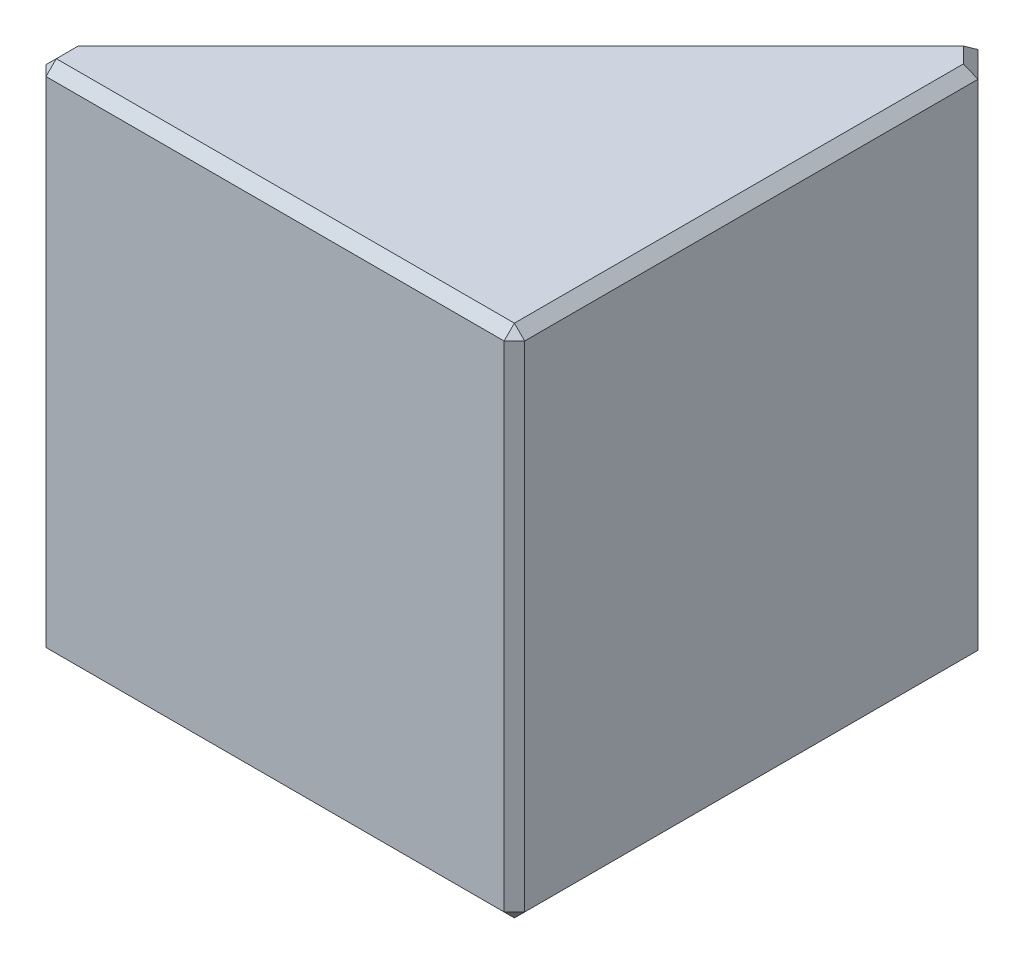
from build123d import *
from OCP.BRepFilletAPI import BRepFilletAPI_MakeChamfer

# Parameters (mm, degrees)
EXTRUDE_1_DEPTH = 50
CHAMFER_1_SIZE  = 5
CHAMFER_1_SIZE2 = 3.535533906
CHAMFER_2_SIZE  = 1


with BuildPart() as part:
    # 草图1 → 凸台-拉伸1 (new body)
    with BuildSketch(Plane(origin=(0, 0, 0), x_dir=(1, 0, 0), z_dir=(0, 1, 0))):
        Polygon((0, 0), (50, 50), (50, 0), align=None)
    extrude(amount=EXTRUDE_1_DEPTH)

    # 倒角1: one chamfer whose edges measure the first distance from different faces: ONE call of the kernel's chamfer builder (chamfer() names one face for all edges)
    chamfer_1_edges_1 = [part.edges().sort_by_distance(p)[0] for p in [
        (0, 25, 0),
    ]]
    chamfer_1_side_1 = [part.faces().sort_by_distance(p)[0] for p in [
        (25, 25, -25),
    ]]
    chamfer_1_edges_2 = [part.edges().sort_by_distance(p)[0] for p in [
        (50, 25, -50),
    ]]
    chamfer_1_side_2 = [part.faces().sort_by_distance(p)[0] for p in [
        (50, 25, -25),
    ]]
    chamfer_1 = BRepFilletAPI_MakeChamfer(part.part.solid().wrapped)
    for e in chamfer_1_edges_1:
        chamfer_1.Add(CHAMFER_1_SIZE, CHAMFER_1_SIZE2, e.wrapped, chamfer_1_side_1[0].wrapped)  # the first distance lies on this face
    for e in chamfer_1_edges_2:
        chamfer_1.Add(CHAMFER_1_SIZE, CHAMFER_1_SIZE2, e.wrapped, chamfer_1_side_2[0].wrapped)  # the first distance lies on this face
    add(Compound.cast(chamfer_1.Shape()), mode=Mode.REPLACE)

    # 倒角2
    chamfer_2_edges = [part.edges().sort_by_distance(p)[0] for p in [
        (25.517766953, 0, -25.517766953),
        (25.517766953, 50, -25.517766953),
        (26.767766953, 0, 0),
        (3.535533906, 0, -1.767766953),
        (48.75, 0, -46.25),
        (26.767766953, 50, 0),
        (3.535533906, 50, -1.767766953),
        (48.75, 50, -46.25),
        (3.535533906, 25, 0),
        (50, 0, -22.5),
        (50, 25, 0),
        (50, 50, -22.5),
    ]]
    chamfer(chamfer_2_edges, length=CHAMFER_2_SIZE)


solid = part.part
